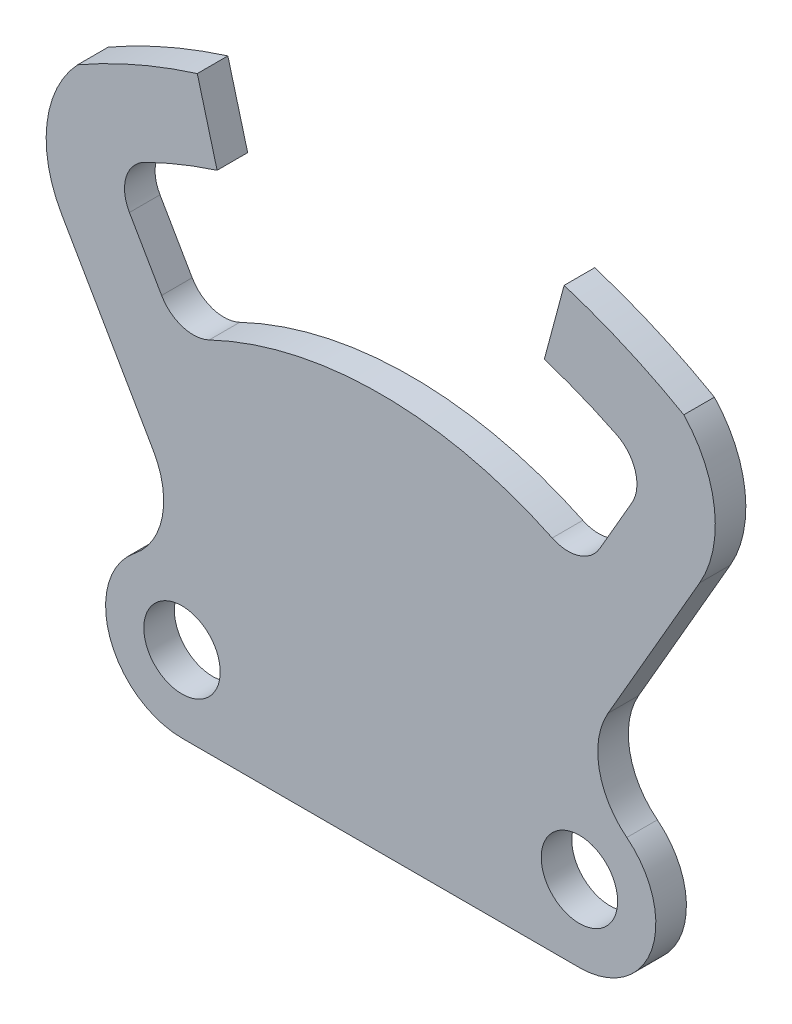
from build123d import *

# Parameters (mm, degrees)
CROQUIS1_R              = 12.5
SALIENTE_EXTRUIR3_DEPTH = 10


with BuildPart() as part:
    # Croquis1 → Saliente-Extruir3 (new body)
    with BuildSketch(Plane.XY):
        with BuildLine():
            Line((-65, 0), (65, 0))
            ThreePointArc((65, 0), (88.615469852, 16.795758191), (80.499762007, 44.615233308))
            ThreePointArc((80.499762007, 44.615233308), (71.445806296, 59.527813514), (74.34888892, 76.730466615))
            Line((74.34888892, 76.730466615), (104.34888892, 128.691990842))
            ThreePointArc((104.34888892, 128.691990842), (109.189179993, 152.050160185), (99.153741511, 173.690919579))
            ThreePointArc((99.153741511, 173.690919579), (80.034708306, 183.287875939), (60, 190.787840283))
            Line((60, 190.787840283), (53.522714622, 166.614282159))
            ThreePointArc((53.522714622, 166.614282159), (65.481747035, 162.287217011), (77.094946128, 157.103053062))
            ThreePointArc((77.094946128, 157.103053062), (83.288324785, 149.82485993), (82.200740382, 140.330272281))
            Line((82.200740382, 140.330272281), (71.673300788, 122.09621203))
            ThreePointArc((71.673300788, 122.09621203), (64.832856812, 116.63391364), (56.102320229, 117.271180027))
            ThreePointArc((56.102320229, 117.271180027), (0, 130), (-56.102320229, 117.271180027))
            ThreePointArc((-56.102320229, 117.271180027), (-64.832856812, 116.63391364), (-71.673300788, 122.09621203))
            Line((-71.673300788, 122.09621203), (-82.200740382, 140.330272281))
            ThreePointArc((-82.200740382, 140.330272281), (-83.288324785, 149.82485993), (-77.094946128, 157.103053062))
            ThreePointArc((-77.094946128, 157.103053062), (-65.481747035, 162.287217011), (-53.522714622, 166.614282159))
            Line((-53.522714622, 166.614282159), (-60, 190.787840283))
            ThreePointArc((-60, 190.787840283), (-80.034708306, 183.287875939), (-99.153741511, 173.690919579))
            ThreePointArc((-99.153741511, 173.690919579), (-109.189179993, 152.050160185), (-104.34888892, 128.691990842))
            Line((-104.34888892, 128.691990842), (-74.34888892, 76.730466615))
            ThreePointArc((-74.34888892, 76.730466615), (-71.445806296, 59.527813514), (-80.499762007, 44.615233308))
            ThreePointArc((-80.499762007, 44.615233308), (-88.615469852, 16.795758191), (-65, 0))
        make_face()
        with Locations((65, 25)):
            Circle(CROQUIS1_R, mode=Mode.SUBTRACT)
        with Locations(Location((-65, 25, 0), (0, 0, 180))):
            Circle(CROQUIS1_R, mode=Mode.SUBTRACT)
    extrude(amount=SALIENTE_EXTRUIR3_DEPTH)


solid = part.part
